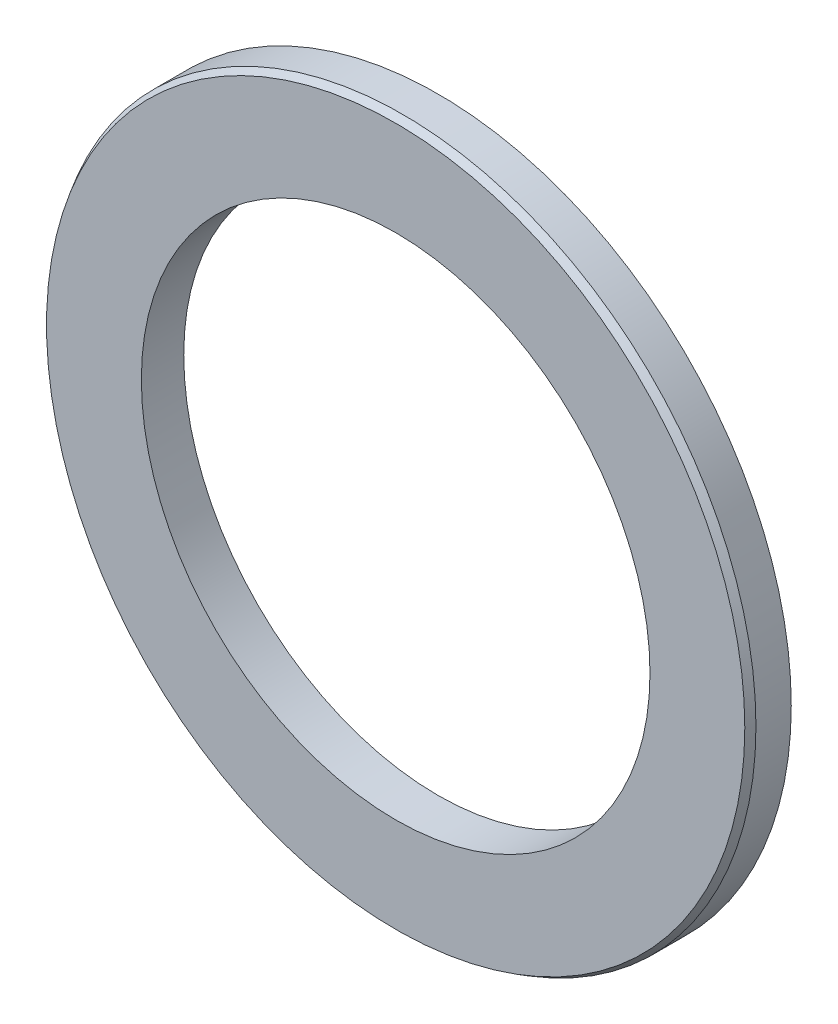
from build123d import *

# Parameters (mm, degrees)
SKETCH_1_R          = 25
EXTRUDE_2_DEPTH     = 3
SKETCH_2_R          = 18
CUT_EXTRUDE_1_DEPTH = 36.482389998
CHAMFER_1_SIZE      = 0.5
CHAMFER_1_SIZE2     = 0.288675135


with BuildPart() as part:
    # 草图1 → 拉伸2 (new body)
    with BuildSketch(Plane.XY):
        Circle(SKETCH_1_R)
    extrude(amount=EXTRUDE_2_DEPTH)

    # 草图2 → 切除-拉伸1 (cut, through all)
    with BuildSketch(Plane.XY.offset(3)):
        Circle(SKETCH_2_R)
    extrude(amount=-CUT_EXTRUDE_1_DEPTH, mode=Mode.SUBTRACT)

    # 倒角1
    chamfer_1_edges = [part.edges().sort_by_distance(p)[0] for p in [
        (-25, 0, 3),
    ]]
    chamfer_1_side = [part.faces().sort_by_distance(p)[0] for p in [
        (-25, 0, 1.5),
    ]]
    chamfer(chamfer_1_edges, length=CHAMFER_1_SIZE, length2=CHAMFER_1_SIZE2, reference=chamfer_1_side[0])


solid = part.part
